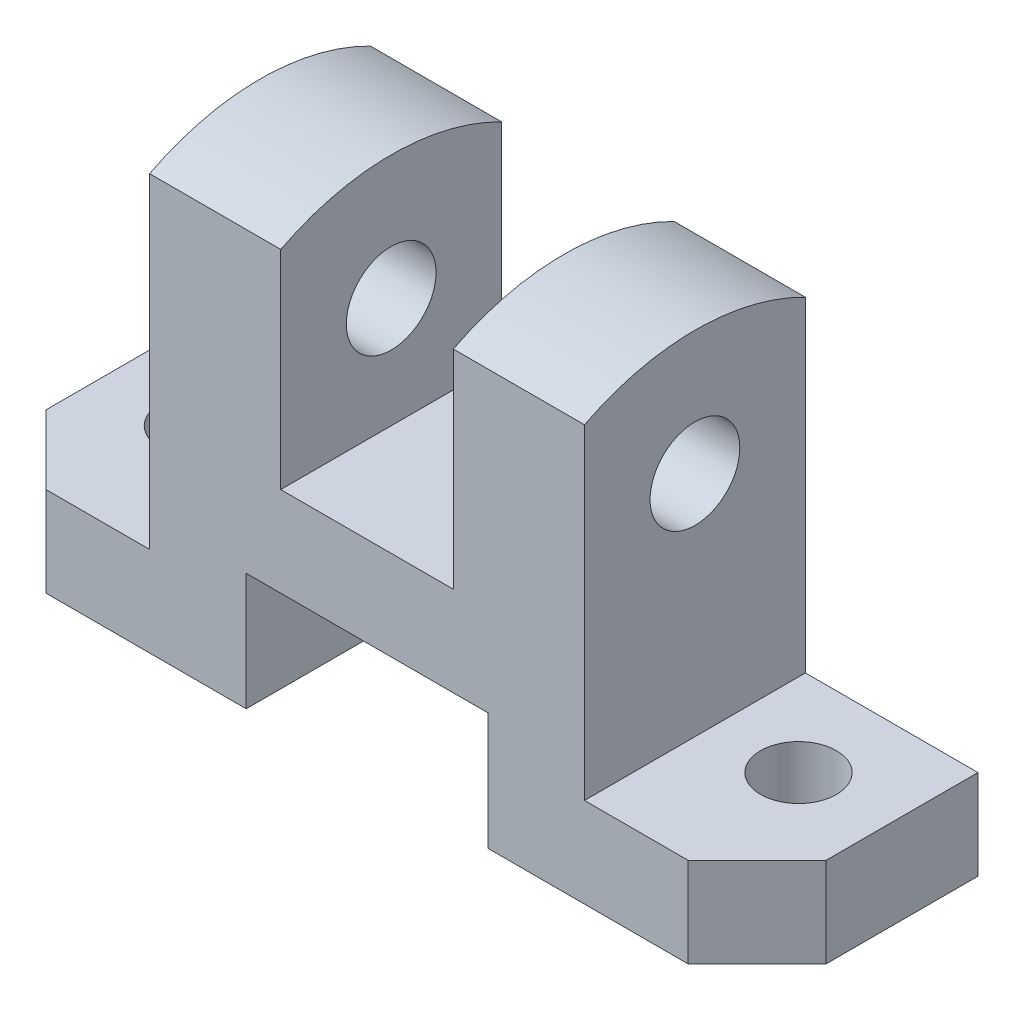
from build123d import *

# Parameters (mm, degrees)
SKETCH2_R                = 5.5
BOSS_EXTRUDE1_DEPTH      = 13
BOSS_EXTRUDE1_2_DEPTH    = 13
BOSS_EXTRUDE2_DEPTH      = 32
BOSS_EXTRUDE3_DEPTH      = 19
BOSS_EXTRUDE3_DEPTH_BACK = 44
SKETCH6_R                = 6.5
SKETCH9_W                = 25
SKETCH9_H                = 34
CUT_EXTRUDE1_DEPTH       = 34


with BuildPart() as part:
    # Sketch2 → Boss-Extrude1 (new body)
    with BuildSketch(Plane(origin=(0, 0, 0), x_dir=(1, 0, 0), z_dir=(0, 1, 0))):
        Polygon((17.5, 0), (56.5, 0), (56.5, -22), (46.5, -32), (17.5, -32), align=None)
        with Locations(Location((43.5, -13, 0), (0, 0, 90))):
            Circle(SKETCH2_R, mode=Mode.SUBTRACT)
    extrude(amount=BOSS_EXTRUDE1_DEPTH)



with BuildPart() as body_2:
    # Sketch2 → Boss-Extrude1 2 (new body)
    with BuildSketch(Plane(origin=(0, 0, 0), x_dir=(1, 0, 0), z_dir=(0, 1, 0))):
        Polygon((-17.5, 0), (-17.5, -32), (-46.5, -32), (-56.5, -22), (-56.5, 0), align=None)
        with Locations(Location((-43.5, -13, 0), (0, 0, 90))):
            Circle(SKETCH2_R, mode=Mode.SUBTRACT)
    extrude(amount=BOSS_EXTRUDE1_2_DEPTH)


with BuildPart() as part_1:
    add(part.part)

    add(body_2.part)  # Boss-Extrude2 merges body 2
    # Sketch3 → Boss-Extrude2 (add)
    with BuildSketch(Plane.XY):
        Polygon((-17.5, 13), (-31.5, 13), (-31.5, 29), (-12.5, 29), (-12.5, 30), (12.5, 30), (12.5, 29), (31.5, 29), (31.5, 13), (17.5, 13), (17.5, 17), (12.5, 17), (-12.5, 17), (-17.5, 17), align=None)
    extrude(amount=BOSS_EXTRUDE2_DEPTH)

    # Sketch6 → Boss-Extrude3 (add, two sides: drawn at the far end of the back side and taken through both)
    with BuildSketch(Plane(origin=(12.5, 0, 0), x_dir=(0, 0, -1), z_dir=(1, 0, 0)).offset(-BOSS_EXTRUDE3_DEPTH_BACK)):
        with BuildLine():
            Line((-32, 29), (0, 29))
            Line((0, 29), (0, 60.128764833))
            ThreePointArc((0, 60.128764833), (-16, 64), (-32, 60.128764833))
            Line((-32, 60.128764833), (-32, 29))
        make_face()
        with Locations((-16, 46)):
            Circle(SKETCH6_R, mode=Mode.SUBTRACT)
    extrude(amount=BOSS_EXTRUDE3_DEPTH + BOSS_EXTRUDE3_DEPTH_BACK)

    # Sketch9 → Cut-Extrude1 (cut)
    with BuildSketch(Plane.XY.offset(32)):
        with Locations((0, 47)):
            Rectangle(SKETCH9_W, SKETCH9_H)
    extrude(amount=-CUT_EXTRUDE1_DEPTH, mode=Mode.SUBTRACT)


solid = part_1.part
